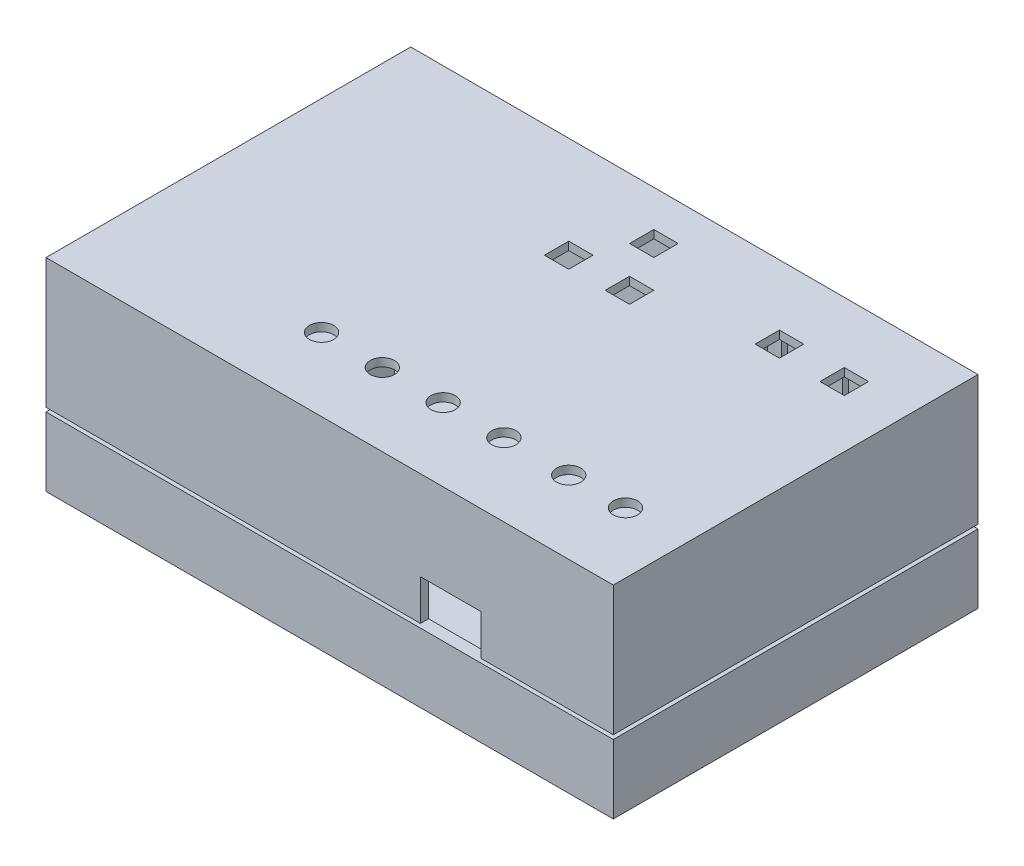
from build123d import *

# Parameters (mm, degrees)
SKETCH1_W                  = 140
SKETCH1_H                  = 90
BASE_DEPTH                 = 17
EXTRUDING_BASE_T           = -3
SKETCH3_W                  = 8
SKETCH3_H                  = 5
EXTERNAL_POWER_SPACE_DEPTH = 10
SKETCH6_W                  = 140
SKETCH6_H                  = 90
UPPER_SURFACE_DEPTH        = 32
SHELL12_T                  = -2
SKETCH4_W                  = 30
SKETCH4_H                  = 50
BATTERY_SPACE_DEPTH        = 20
CUT_EXTRUDE3_DEPTH         = 20
CUT_EXTRUDE10_DEPTH        = 20
SKETCH8_R                  = 3
LED_DEPTH                  = 5
SKETCH9_W                  = 15
SKETCH9_H                  = 10
OUTPUT_WIRE_DEPTH          = 5
SKETCH10_W                 = 6
SKETCH10_H                 = 6
PUSHBUTTONS_DEPTH          = 5
SKETCH11_W                 = 1.5
SKETCH11_H                 = 30
AIRFLOW_HOLES_DEPTH        = 5
AIRSUPPORT_COUNT           = 10
AIRSUPPORT_PITCH           = 5
CUT_EXTRUDE9_DEPTH         = 5
SKETCH12_W                 = 30
SKETCH12_H                 = 50
BOSS_EXTRUDE4_DEPTH        = 2


with BuildPart() as part:
    # Sketch1 → Base (new body)
    with BuildSketch(Plane(origin=(0, 0, 0), x_dir=(1, 0, 0), z_dir=(0, 1, 0))):
        with Locations((70, 45)):
            Rectangle(SKETCH1_W, SKETCH1_H)
    extrude(amount=BASE_DEPTH)

    # Extruding Base
    extruding_base_openings = [part.faces().sort_by_distance(p)[0] for p in [
        (70, 17, -45),
    ]]
    offset(amount=EXTRUDING_BASE_T, openings=extruding_base_openings, kind=Kind.INTERSECTION)

    # Sketch3 → External Power Space (cut)
    with BuildSketch(Plane.ZY):
        with Locations((-68, 14.5)):
            Rectangle(SKETCH3_W, SKETCH3_H)
    extrude(amount=-EXTERNAL_POWER_SPACE_DEPTH, mode=Mode.SUBTRACT)

    # Sketch4 → Battery Space (add)
    with BuildSketch(Plane(origin=(0, 3, 0), x_dir=(1, 0, 0), z_dir=(0, 1, 0))):
        with Locations((18, 28)):
            Rectangle(SKETCH4_W, SKETCH4_H)
    extrude(amount=BATTERY_SPACE_DEPTH)

    # 3DSketch1 → Cut-Extrude3 (cut)
    with BuildSketch(Plane(origin=(5, 23, -5), x_dir=(0.49205725666790157, 0, -0.8705628387201345), z_dir=(0, -1, 0))):
        Polygon((0, 0), (12.793488673, 22.634633807), (52.839379254, 0), (40.045890581, -22.634633807), align=None)
    extrude(amount=CUT_EXTRUDE3_DEPTH, mode=Mode.SUBTRACT)

    # Sketch13 → Cut-Extrude10 (cut)
    with BuildSketch(Plane(origin=(0, 23, 0), x_dir=(1, 0, 0), z_dir=(0, 1, 0))):
        Polygon((7.443398723, 50.984772634), (8.600912051, 51.010355471), (9.157513328, 52.025582837), (8.556601277, 53.015227366), (7.399087949, 52.989644529), (6.842486672, 51.974417163), align=None)
    extrude(amount=-CUT_EXTRUDE10_DEPTH, mode=Mode.SUBTRACT)


with BuildPart() as body_2:
    # Sketch6 → Upper Surface (new body)
    with BuildSketch(Plane(origin=(0, 50, 0), x_dir=(-1, 0, 0), z_dir=(0, -1, 0))):
        with Locations((-70, 45)):
            Rectangle(SKETCH6_W, SKETCH6_H)
    extrude(amount=UPPER_SURFACE_DEPTH)

    # Shell12
    shell12_openings = [body_2.faces().sort_by_distance(p)[0] for p in [
        (70, 18, -45),
    ]]
    offset(amount=SHELL12_T, openings=shell12_openings, kind=Kind.INTERSECTION)

    # Sketch8 → LED (cut)
    with BuildSketch(Plane(origin=(0, 50, 0), x_dir=(1, 0, 0), z_dir=(0, 1, 0))):
        with Locations(Location((125, 18, 0), (0, 0, 270))):
            Circle(SKETCH8_R)
        with Locations(Location((111, 18, 0), (0, 0, 270))):
            Circle(SKETCH8_R)
        with Locations(Location((95, 18, 0), (0, 0, 270))):
            Circle(SKETCH8_R)
        with Locations(Location((80, 18, 0), (0, 0, 270))):
            Circle(SKETCH8_R)
        with Locations(Location((65, 18, 0), (0, 0, 270))):
            Circle(SKETCH8_R)
        with Locations(Location((50, 18, 0), (0, 0, 270))):
            Circle(SKETCH8_R)
    extrude(amount=-LED_DEPTH, mode=Mode.SUBTRACT)

    # Sketch9 → OUTPUT Wire (cut)
    with BuildSketch(Plane.XY):
        with Locations((99.897547045, 23)):
            Rectangle(SKETCH9_W, SKETCH9_H)
    extrude(amount=-OUTPUT_WIRE_DEPTH, mode=Mode.SUBTRACT)

    # Sketch10 → PushButtons (cut)
    with BuildSketch(Plane(origin=(0, 50, 0), x_dir=(1, 0, 0), z_dir=(0, 1, 0))):
        with Locations((125, 72)):
            Rectangle(SKETCH10_W, SKETCH10_H)
        with Locations((109, 72)):
            Rectangle(SKETCH10_W, SKETCH10_H)
        with Locations((72, 78)):
            Rectangle(SKETCH10_W, SKETCH10_H)
        with Locations((79, 65)):
            Rectangle(SKETCH10_W, SKETCH10_H)
        with Locations((64, 65)):
            Rectangle(SKETCH10_W, SKETCH10_H)
    extrude(amount=-PUSHBUTTONS_DEPTH, mode=Mode.SUBTRACT)


with BuildPart() as airflow_holes_tool:
    # Sketch11 → AirFlow Holes (new body)
    with BuildSketch(Plane(origin=(0, 0, -90), x_dir=(-1, 0, 0), z_dir=(0, 0, -1))):
        with Locations((-114.25, 26)):
            Rectangle(SKETCH11_W, SKETCH11_H)
    airflow_holes = extrude(amount=-AIRFLOW_HOLES_DEPTH)


with BuildPart() as part_1:
    add(part.part)

    # AirFlow Holes: cut by airflow_holes_tool
    add(airflow_holes_tool.part, mode=Mode.SUBTRACT)


with BuildPart() as body_2_1:
    add(body_2.part)

    # AirFlow Holes: cut by airflow_holes_tool
    add(airflow_holes_tool.part, mode=Mode.SUBTRACT)


with BuildPart() as airsupport_tool:
    # AirSupport: AirFlow Holes ×10
    with Locations(*[(-i * AIRSUPPORT_PITCH, 0, 0) for i in range(1, AIRSUPPORT_COUNT)]):
        add(airflow_holes)


with BuildPart() as part_2:
    add(part_1.part)

    # AirSupport: cut by airsupport_tool
    add(airsupport_tool.part, mode=Mode.SUBTRACT)

    # 3DSketch2 → Cut-Extrude9 (cut)
    with BuildSketch(Plane(origin=(30.995, 3, -5.005), x_dir=(-0.49199487808425185, 0, -0.8705980932318094), z_dir=(0, 1, 0))):
        Polygon((0, 0), (40.038806308, -22.626844443), (52.825753189, 0), (12.786946881, 22.626844443), align=None)
    extrude(amount=-CUT_EXTRUDE9_DEPTH, mode=Mode.SUBTRACT)

    # Sketch12 → Boss-Extrude4 (add)
    with BuildSketch(Plane(origin=(0, 23, 0), x_dir=(1, 0, 0), z_dir=(0, 1, 0))):
        with Locations((18, 28)):
            Rectangle(SKETCH12_W, SKETCH12_H)
    extrude(amount=BOSS_EXTRUDE4_DEPTH)


with BuildPart() as body_2_2:
    add(body_2_1.part)

    # AirSupport: cut by airsupport_tool
    add(airsupport_tool.part, mode=Mode.SUBTRACT)


solid = Compound([part_2.part, body_2_2.part])
